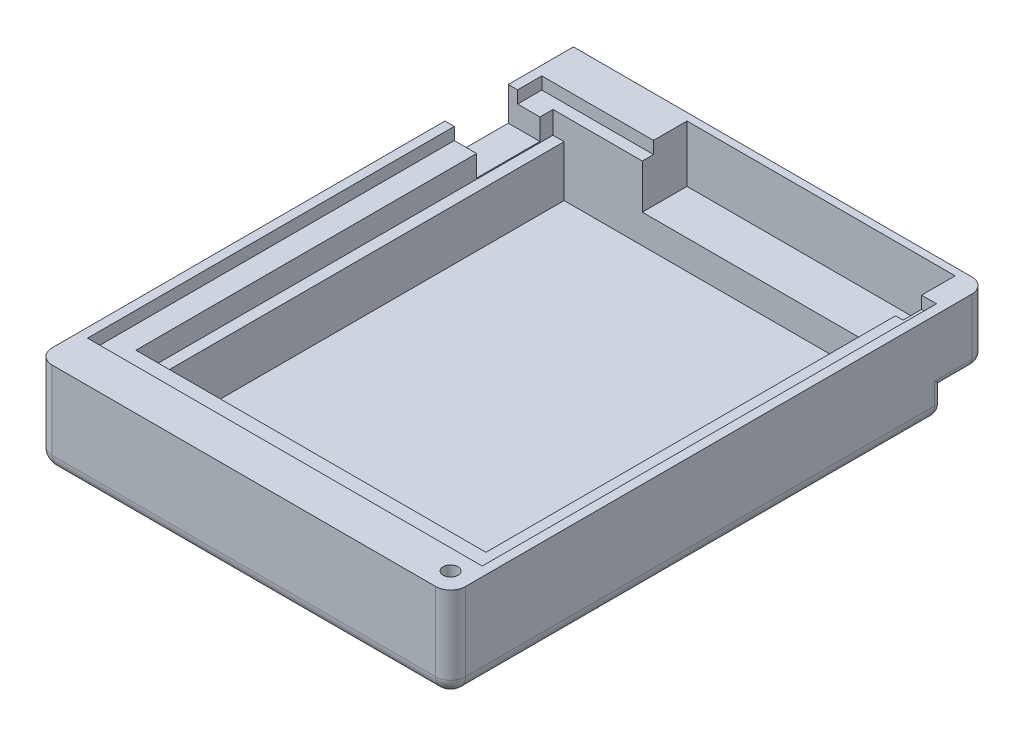
from build123d import *

# Parameters (mm, degrees)
SKETCH1_W           = 55.5
SKETCH1_H           = 72
BOSS_EXTRUDE1_DEPTH = 12.5
SKETCH2_W           = 53
SKETCH2_H           = 61
CUT_EXTRUDE1_DEPTH  = 1.65
SKETCH3_W           = 44
SKETCH3_H           = 63.5
CUT_EXTRUDE2_DEPTH  = 11.5
SKETCH4_W           = 44
SKETCH4_H           = 4
BOSS_EXTRUDE2_DEPTH = 6.5
SKETCH5_W           = 44
SKETCH5_H           = 3.5
BOSS_EXTRUDE3_DEPTH = 3
SKETCH6_W           = 1.5
SKETCH6_H           = 56
CUT_EXTRUDE3_DEPTH  = 3
SKETCH7_W           = 7
SKETCH7_H           = 8.5
CUT_EXTRUDE4_DEPTH  = 4.5
SKETCH8_W           = 36
SKETCH8_H           = 7
CUT_EXTRUDE5_DEPTH  = 7.6
SKETCH9_W           = 39.25
SKETCH9_H           = 3.9
CUT_EXTRUDE6_DEPTH  = 6
FILLET2_R           = 2
FILLET3_R           = 1
SKETCH10_R          = 1
CUT_EXTRUDE7_DEPTH  = 48.14140961


with BuildPart() as part:
    # Sketch1 → Boss-Extrude1 (new body)
    with BuildSketch(Plane(origin=(0, 0, 0), x_dir=(1, 0, 0), z_dir=(0, 1, 0))):
        Rectangle(SKETCH1_W, SKETCH1_H)
    extrude(amount=BOSS_EXTRUDE1_DEPTH)

    # Sketch2 → Cut-Extrude1 (cut)
    with BuildSketch(Plane(origin=(0, 12.5, 0), x_dir=(1, 0, 0), z_dir=(0, 1, 0))):
        Rectangle(SKETCH2_W, SKETCH2_H)
    extrude(amount=-CUT_EXTRUDE1_DEPTH, mode=Mode.SUBTRACT)

    # Sketch3 → Cut-Extrude2 (cut)
    with BuildSketch(Plane(origin=(0, 12.5, 0), x_dir=(1, 0, 0), z_dir=(0, 1, 0))):
        with Locations((0, -2.75)):
            Rectangle(SKETCH3_W, SKETCH3_H)
    extrude(amount=-CUT_EXTRUDE2_DEPTH, mode=Mode.SUBTRACT)

    # Sketch4 → Boss-Extrude2 (add)
    with BuildSketch(Plane(origin=(0, 12.5, 0), x_dir=(1, 0, 0), z_dir=(0, 1, 0))):
        with Locations((0, -32.5)):
            Rectangle(SKETCH4_W, SKETCH4_H)
    extrude(amount=-BOSS_EXTRUDE2_DEPTH)

    # Sketch5 → Boss-Extrude3 (add)
    with BuildSketch(Plane(origin=(0, 10.85, 0), x_dir=(1, 0, 0), z_dir=(0, 1, 0))):
        with Locations((0, -28.75)):
            Rectangle(SKETCH5_W, SKETCH5_H)
    extrude(amount=-BOSS_EXTRUDE3_DEPTH)

    # Sketch6 → Cut-Extrude3 (cut)
    with BuildSketch(Plane(origin=(0, 10.85, 0), x_dir=(1, 0, 0), z_dir=(0, 1, 0))):
        with Locations((22.75, 1)):
            Rectangle(SKETCH6_W, SKETCH6_H)
        with Locations((-22.75, 1)):
            Rectangle(SKETCH6_W, SKETCH6_H)
    extrude(amount=-CUT_EXTRUDE3_DEPTH, mode=Mode.SUBTRACT)

    # Sketch7 → Cut-Extrude4 (cut)
    with BuildSketch(Plane(origin=(0, 12.5, 0), x_dir=(1, 0, 0), z_dir=(0, 1, 0))):
        with Locations((-24.25, 23)):
            Rectangle(SKETCH7_W, SKETCH7_H)
    extrude(amount=-CUT_EXTRUDE4_DEPTH, mode=Mode.SUBTRACT)

    # Sketch8 → Cut-Extrude5 (cut)
    with BuildSketch(Plane(origin=(0, 12.5, 0), x_dir=(1, 0, 0), z_dir=(0, 1, 0))):
        with Locations((6.5, 31.5)):
            Rectangle(SKETCH8_W, SKETCH8_H)
    extrude(amount=-CUT_EXTRUDE5_DEPTH, mode=Mode.SUBTRACT)

    # Sketch9 → Cut-Extrude6 (cut)
    with BuildSketch(Plane(origin=(0, 0, -36), x_dir=(-1, 0, 0), z_dir=(0, 0, -1))):
        with Locations((-8.125, 1.95)):
            Rectangle(SKETCH9_W, SKETCH9_H)
    extrude(amount=-CUT_EXTRUDE6_DEPTH, mode=Mode.SUBTRACT)

    # Fillet2
    fillet2_edges = [part.edges().sort_by_distance(p)[0] for p in [
        (-19.625, 0, -36),
        (27.75, 0, 3),
        (0, 0, 36),
        (-27.75, 0, 0),
        (27.75, 8.2, -36),
        (27.75, 6.25, 36),
        (-27.75, 6.25, 36),
    ]]
    fillet(fillet2_edges, radius=FILLET2_R)

    # Fillet3
    fillet3_edges = [part.edges().sort_by_distance(p)[0] for p in [
        (27.75, 2.95, -30),
        (27.75, 3.9, -32),
        (-11.5, 0, -32),
        (7.125, 3.9, -36),
        (-11.5, 2.95, -36),
        (7.125, 0, -30),
        (-11.5, 0.585786438, -35.414213562),
        (27.164213562, 0.585786438, -30),
        (27.164213562, 3.9, -35.414213562),
    ]]
    fillet(fillet3_edges, radius=FILLET3_R)

    # Sketch10 → Cut-Extrude7 (cut, through all)
    with BuildSketch(Plane(origin=(0, 12.5, 0), x_dir=(1, 0, 0), z_dir=(0, 1, 0))):
        with Locations(Location((24.95, -33.2, 0), (0, 0, 270))):
            Circle(SKETCH10_R)
    extrude(amount=-CUT_EXTRUDE7_DEPTH, mode=Mode.SUBTRACT)


solid = part.part
